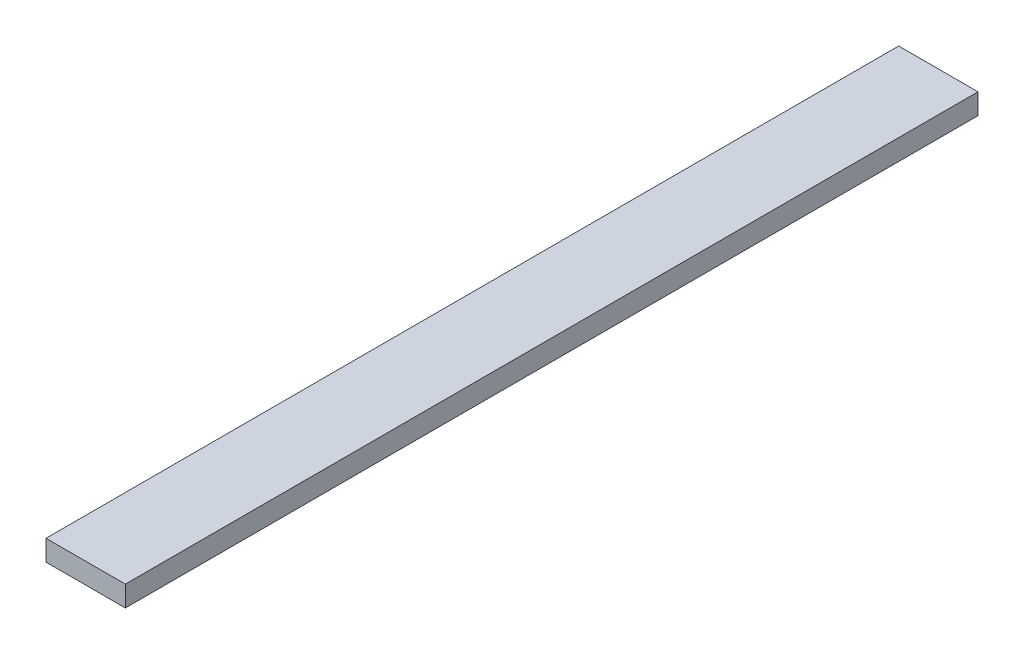
from build123d import *

# Parameters (mm, degrees)
SKETCH1_W           = 24.346000076
SKETCH1_H           = 261.645999948
BOSS_EXTRUDE1_DEPTH = 6.35


with BuildPart() as part:
    # Sketch1 → Boss-Extrude1 (new body)
    with BuildSketch(Plane(origin=(0, 0, 0), x_dir=(1, 0, 0), z_dir=(0, 1, 0))):
        with Locations((12.173000038, 0)):
            Rectangle(SKETCH1_W, SKETCH1_H)
    extrude(amount=BOSS_EXTRUDE1_DEPTH)


solid = part.part
